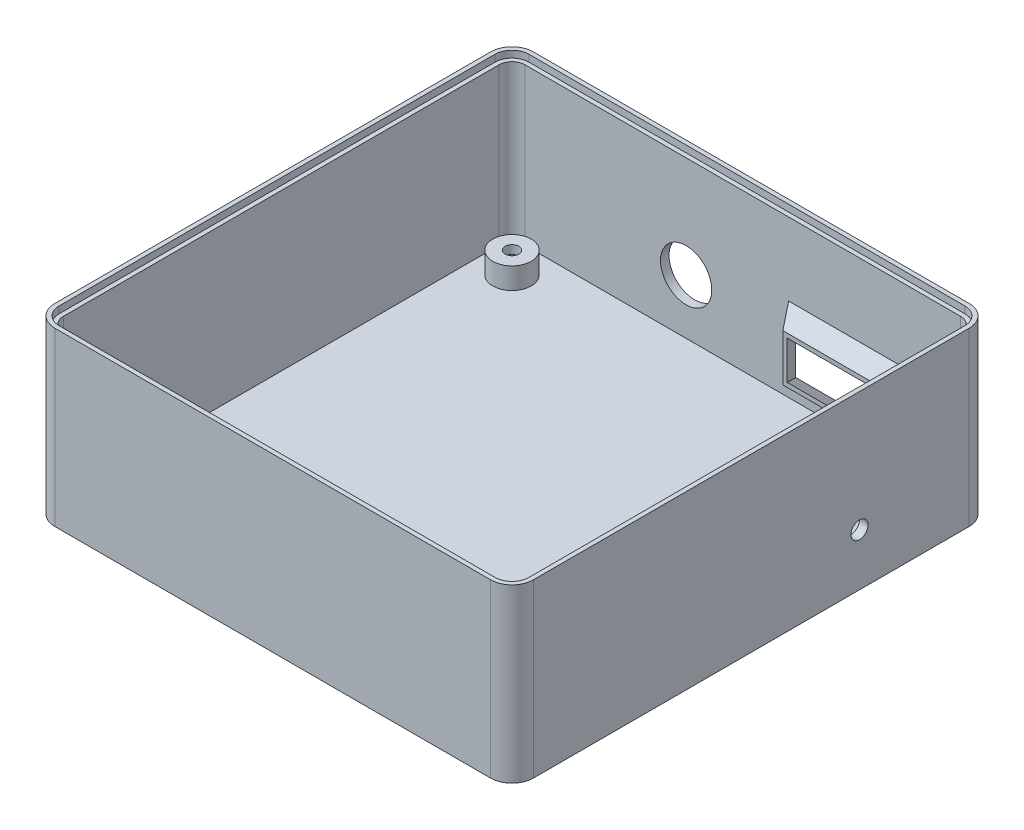
from build123d import *

# Parameters (mm, degrees)
BOSS_EXTRUDE1_DEPTH  = 40.2
CUT_EXTRUDE1_DEPTH   = 1.6
CUT_EXTRUDE2_DEPTH   = 36.6
SKETCH6_R            = 4.5
BOSS_EXTRUDE2_DEPTH  = 5
SKETCH10_R           = 1.6
CUT_EXTRUDE4_DEPTH   = 86.873395182
SKETCH11_R           = 3.5
CUT_EXTRUDE6_DEPTH   = 5
LPATTERN1_COUNT      = 2
LPATTERN1_PITCH      = 93
LPATTERN1_COUNT_DIR2 = 2
LPATTERN1_PITCH_DIR2 = 93
CUT_EXTRUDE7_REACH   = 139.233
SKETCH21_R           = 2
CUT_EXTRUDE8_REACH   = 133.514
SKETCH22_R           = 6


with BuildPart() as part:
    # Sketch1 → Boss-Extrude1 (new body)
    with BuildSketch(Plane(origin=(0, 0, 0), x_dir=(1, 0, 0), z_dir=(0, 1, 0))):
        with BuildLine():
            Line((-51, -56), (51, -56))
            ThreePointArc((51, -56), (54.535533906, -54.535533906), (56, -51))
            Line((56, -51), (56, 51))
            ThreePointArc((56, 51), (54.535533906, 54.535533906), (51, 56))
            Line((51, 56), (-51, 56))
            ThreePointArc((-51, 56), (-54.535533906, 54.535533906), (-56, 51))
            Line((-56, 51), (-56, -51))
            ThreePointArc((-56, -51), (-54.535533906, -54.535533906), (-51, -56))
        make_face()
    extrude(amount=BOSS_EXTRUDE1_DEPTH)

    # Sketch3 → Cut-Extrude1 (cut)
    with BuildSketch(Plane(origin=(0, 40.2, 0), x_dir=(1, 0, 0), z_dir=(0, 1, 0))):
        with BuildLine():
            Line((-51, -55), (51, -55))
            ThreePointArc((51, -55), (53.828427125, -53.828427125), (55, -51))
            Line((55, -51), (55, 51))
            ThreePointArc((55, 51), (53.828427125, 53.828427125), (51, 55))
            Line((51, 55), (-51, 55))
            ThreePointArc((-51, 55), (-53.828427125, 53.828427125), (-55, 51))
            Line((-55, 51), (-55, -51))
            ThreePointArc((-55, -51), (-53.828427125, -53.828427125), (-51, -55))
        make_face()
    extrude(amount=-CUT_EXTRUDE1_DEPTH, mode=Mode.SUBTRACT)

    # Sketch4 → Cut-Extrude2 (cut)
    with BuildSketch(Plane(origin=(0, 38.6, 0), x_dir=(1, 0, 0), z_dir=(0, 1, 0))):
        with BuildLine():
            Line((-51, -54), (51, -54))
            ThreePointArc((51, -54), (53.121320344, -53.121320344), (54, -51))
            Line((54, -51), (54, 51))
            ThreePointArc((54, 51), (53.121320344, 53.121320344), (51, 54))
            Line((51, 54), (-51, 54))
            ThreePointArc((-51, 54), (-53.121320344, 53.121320344), (-54, 51))
            Line((-54, 51), (-54, -51))
            ThreePointArc((-54, -51), (-53.121320344, -53.121320344), (-51, -54))
        make_face()
    extrude(amount=-CUT_EXTRUDE2_DEPTH, mode=Mode.SUBTRACT)

    # Sketch6 → Boss-Extrude2 (add)
    with BuildSketch(Plane(origin=(0, 2, 0), x_dir=(1, 0, 0), z_dir=(0, 1, 0))):
        with Locations(Location((-46.5, 46.5, 0), (0, 0, 270))):
            Circle(SKETCH6_R)
    boss_extrude2 = extrude(amount=BOSS_EXTRUDE2_DEPTH)

    # Sketch10 → Cut-Extrude4 (cut, symmetric)
    with BuildSketch(Plane(origin=(0, 7, 0), x_dir=(1, 0, 0), z_dir=(0, 1, 0))):
        with Locations(Location((-46.5, 46.5, 0), (0, 0, 90))):
            Circle(SKETCH10_R)
    cut_extrude4 = extrude(amount=CUT_EXTRUDE4_DEPTH, both=True, mode=Mode.SUBTRACT)

    # Sketch11 → Cut-Extrude6 (cut)
    with BuildSketch(Plane.XZ):
        with Locations(Location((-46.5, -46.5, 0), (0, 0, 270))):
            Circle(SKETCH11_R)
    cut_extrude6 = extrude(amount=-CUT_EXTRUDE6_DEPTH, mode=Mode.SUBTRACT)

    # LPattern1: Boss-Extrude2, Cut-Extrude4, Cut-Extrude6 2 × 2
    with Locations(*[(j * LPATTERN1_PITCH_DIR2, 0, i * LPATTERN1_PITCH) for i in range(LPATTERN1_COUNT) for j in range(LPATTERN1_COUNT_DIR2) if (i, j) != (0, 0)]):
        add(boss_extrude2)
        add(cut_extrude4, mode=Mode.SUBTRACT)
        add(cut_extrude6, mode=Mode.SUBTRACT)

    # Sketch15 → Loft1 section 0
    with BuildSketch(Plane(origin=(0, 0, -56), x_dir=(-1, 0, 0), z_dir=(0, 0, -1))):
        with BuildLine():
            Line((-39.76, 3.9), (-9.4, 3.9))
            Line((-9.4, 3.9), (-9.4, 22.9))
            Line((-9.4, 22.9), (-39.76, 22.9))
            Line((-39.76, 22.9), (-39.76, 3.9))
        make_face()
    # Sketch17 → Loft1 section 1
    with BuildSketch(Plane.XY.offset(-50)):
        with BuildLine():
            Line((35.76, 7.9), (13.4, 7.9))
            Line((13.4, 7.9), (13.4, 18.9))
            Line((13.4, 18.9), (35.76, 18.9))
            Line((35.76, 18.9), (35.76, 7.9))
        make_face()
    loft()

    # Sketch19 → Cut-Loft2 section 0
    with BuildSketch(Plane(origin=(0, 0, -56), x_dir=(-1, 0, 0), z_dir=(0, 0, -1))):
        with BuildLine():
            Line((-38.76, 4.9), (-10.4, 4.9))
            Line((-10.4, 4.9), (-10.4, 21.9))
            Line((-10.4, 21.9), (-38.76, 21.9))
            Line((-38.76, 21.9), (-38.76, 4.9))
        make_face()
    # Sketch18 → Cut-Loft2 section 1
    with BuildSketch(Plane.XY.offset(-50)):
        with BuildLine():
            Line((14.4, 8.9), (34.76, 8.9))
            Line((34.76, 8.9), (34.76, 17.9))
            Line((34.76, 17.9), (14.4, 17.9))
            Line((14.4, 17.9), (14.4, 8.9))
        make_face()
    loft(mode=Mode.SUBTRACT)

    # Sketch21 → Cut-Extrude7 (cut, up to next)
    with BuildSketch(Plane(origin=(56, 0.222876175, 12.489592586), x_dir=(0, 0, -1), z_dir=(1, 0, 0)), mode=Mode.PRIVATE) as cut_extrude7_sk1:
        with Locations((37.808139586, 11.956230245)):
            Circle(SKETCH21_R)
    cut_extrude7_tool1 = extrude(cut_extrude7_sk1.sketch, amount=-CUT_EXTRUDE7_REACH, mode=Mode.PRIVATE) & part.part
    add(cut_extrude7_tool1.solids().sort_by_distance((56, 12.179106, -25.318547))[0], mode=Mode.SUBTRACT)

    # Sketch22 → Cut-Extrude8 (cut, up to next)
    with BuildSketch(Plane(origin=(0, 0, -56), x_dir=(-1, 0, 0), z_dir=(0, 0, -1)), mode=Mode.PRIVATE) as cut_extrude8_sk1:
        with Locations((13.246177, 14.809453668)):
            Circle(SKETCH22_R)
    cut_extrude8_tool1 = extrude(cut_extrude8_sk1.sketch, amount=-CUT_EXTRUDE8_REACH, mode=Mode.PRIVATE) & part.part
    add(cut_extrude8_tool1.solids().sort_by_distance((-13.246177, 14.809454, -56))[0], mode=Mode.SUBTRACT)


solid = part.part
